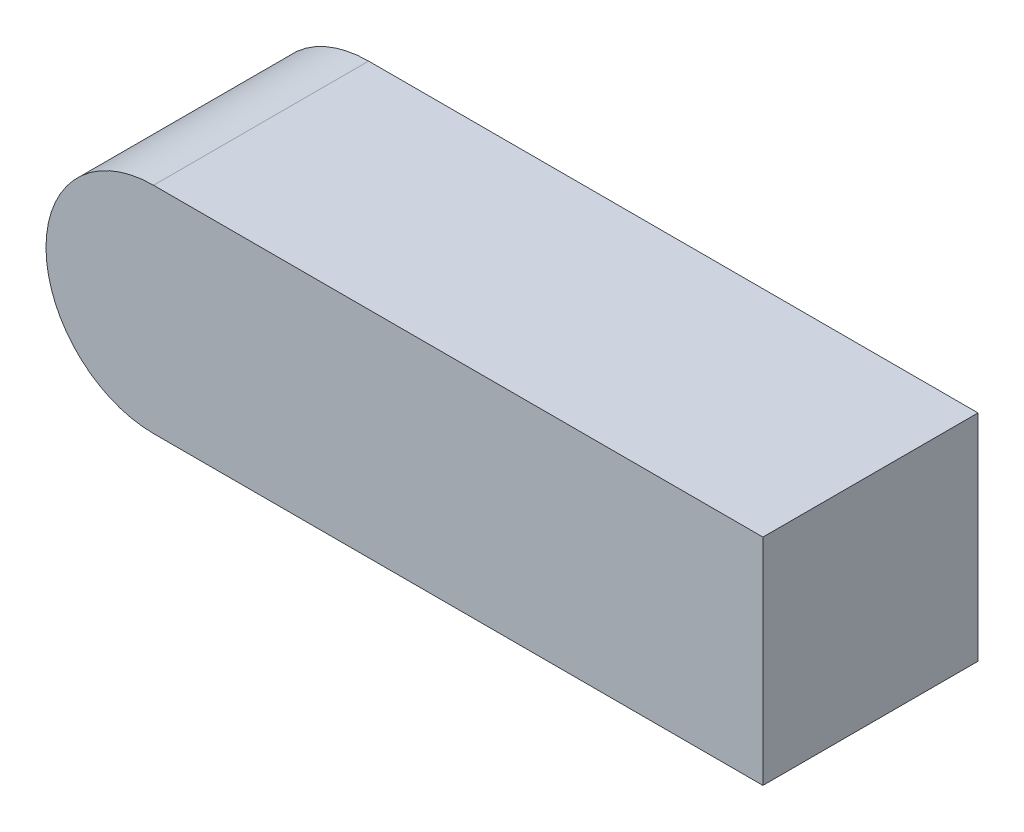
from build123d import *

# Parameters (mm, degrees)
BOSS_EXTRUDE1_DEPTH = 6


with BuildPart() as part:
    # Sketch1 → Boss-Extrude1 (new body)
    with BuildSketch(Plane.XY):
        with BuildLine():
            Line((-17, -3), (0, -3))
            Line((0, -3), (0, 3))
            Line((0, 3), (-17, 3))
            ThreePointArc((-17, 3), (-20, 0), (-17, -3))
        make_face()
    extrude(amount=BOSS_EXTRUDE1_DEPTH)


solid = part.part
